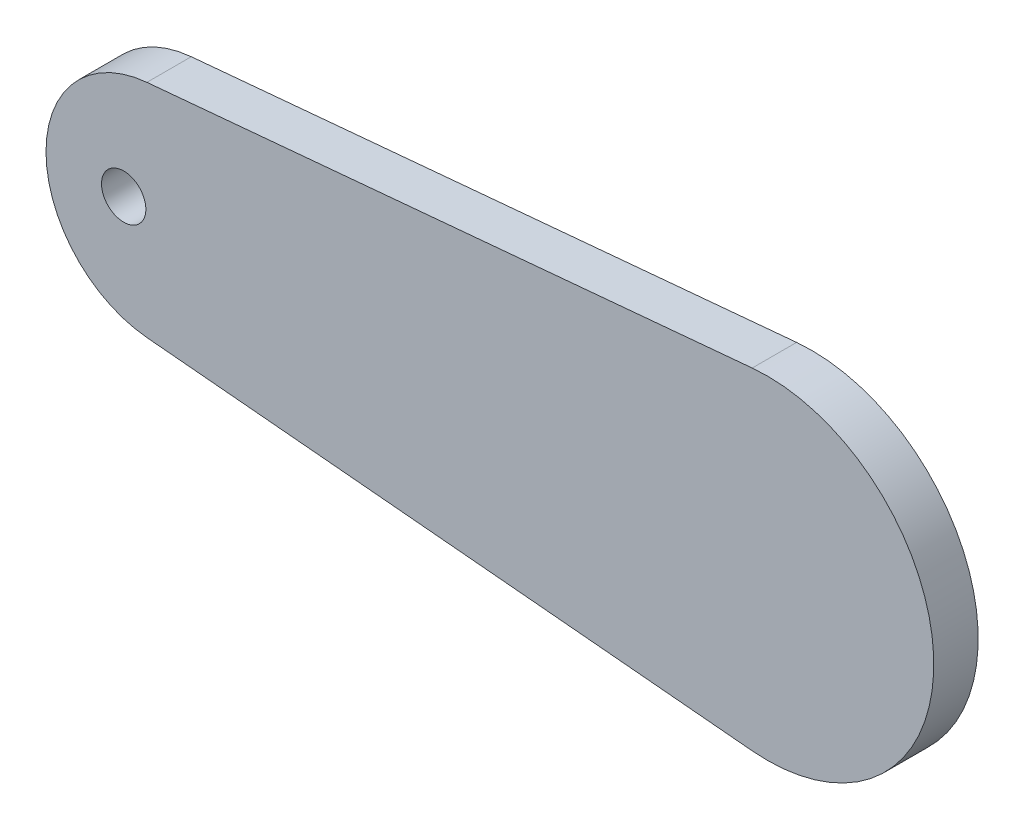
from build123d import *

# Parameters (mm, degrees)
SKETCH1_R           = 2
BOSS_EXTRUDE1_DEPTH = 4


with BuildPart() as part:
    # Sketch1 → Boss-Extrude1 (new body)
    with BuildSketch(Plane.XY):
        with BuildLine():
            Line((-0.909090909, 9.958591955), (53.636363636, 14.937887932))
            ThreePointArc((53.636363636, 14.937887932), (70, 0), (53.636363636, -14.937887932))
            Line((53.636363636, -14.937887932), (-0.909090909, -9.958591955))
            ThreePointArc((-0.909090909, -9.958591955), (-10, 0), (-0.909090909, 9.958591955))
        make_face()
        with Locations((-3, 0)):
            Circle(SKETCH1_R, mode=Mode.SUBTRACT)
    extrude(amount=BOSS_EXTRUDE1_DEPTH)


solid = part.part
